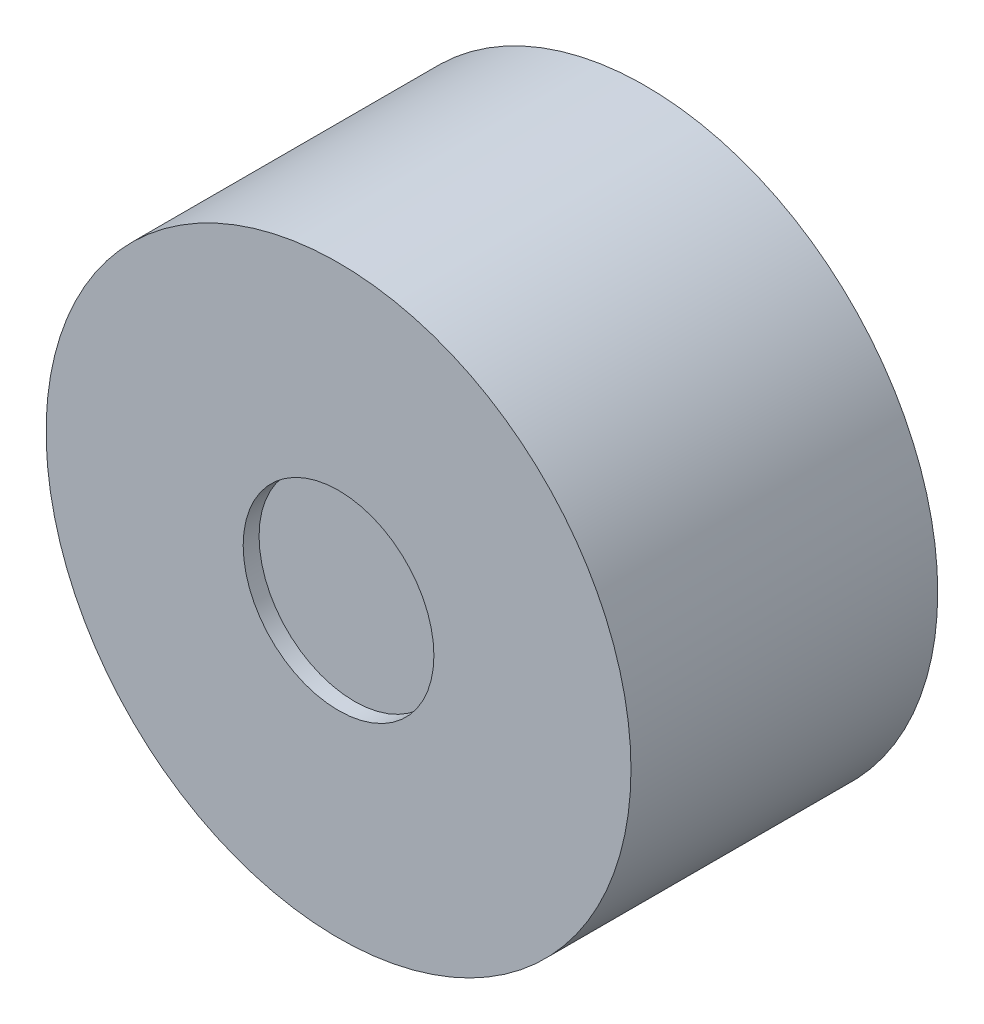
from build123d import *

# Parameters (mm, degrees)
CROQUIS1_R              = 18.4
SALIENTE_EXTRUIR1_DEPTH = 24.3
CROQUIS2_R              = 3
CROQUIS2_R_2            = 1.25
CORTAR_EXTRUIR1_DEPTH   = 5
CORTAR_EXTRUIR2_START   = -5
CROQUIS3_R              = 1.25
CROQUIS3_R_2            = 5
CORTAR_EXTRUIR2_DEPTH   = 5
CORTAR_EXTRUIR3_START   = -5
CROQUIS6_R              = 18.4
CORTAR_EXTRUIR3_DEPTH   = 5
CROQUIS7_R              = 6
CORTAR_EXTRUIR4_DEPTH   = 1


with BuildPart() as part:
    # Croquis1 → Saliente-Extruir1 (new body)
    with BuildSketch(Plane.XY):
        Circle(CROQUIS1_R)
    extrude(amount=SALIENTE_EXTRUIR1_DEPTH)

    # Croquis2 → Cortar-Extruir1 (cut)
    with BuildSketch(Plane.XY.offset(24.3)):
        Circle(CROQUIS2_R)
        with Locations((0, 9.5)):
            Circle(CROQUIS2_R_2)
        with Locations((9.5, 0)):
            Circle(CROQUIS2_R_2)
        with Locations((0, -9.5)):
            Circle(CROQUIS2_R_2)
        with Locations((-9.5, 0)):
            Circle(CROQUIS2_R_2)
    extrude(amount=-CORTAR_EXTRUIR1_DEPTH, mode=Mode.SUBTRACT)

    # Croquis3 → Cortar-Extruir2 (cut)
    with BuildSketch(Plane(origin=(0, 0, 0), x_dir=(-1, 0, 0), z_dir=(0, 0, -1)).offset(CORTAR_EXTRUIR2_START)):
        with Locations(Location((-9.5, 0, 0), (0, 0, 180))):
            Circle(CROQUIS3_R)
        with Locations(Location((0, 9.5, 0), (0, 0, 180))):
            Circle(CROQUIS3_R)
        with Locations(Location((9.5, 0, 0), (0, 0, 180))):
            Circle(CROQUIS3_R)
        with Locations(Location((0, -9.5, 0), (0, 0, 180))):
            Circle(CROQUIS3_R)
        Circle(CROQUIS3_R_2)
    extrude(amount=CORTAR_EXTRUIR2_DEPTH, mode=Mode.SUBTRACT)

    # Croquis6 → Cortar-Extruir3 (cut)
    with BuildSketch(Plane.XY.offset(24.3).offset(CORTAR_EXTRUIR3_START)):
        Circle(CROQUIS6_R)
    extrude(amount=CORTAR_EXTRUIR3_DEPTH, mode=Mode.SUBTRACT)

    # Croquis7 → Cortar-Extruir4 (cut)
    with BuildSketch(Plane.XY.offset(19.3)):
        Circle(CROQUIS7_R)
    extrude(amount=-CORTAR_EXTRUIR4_DEPTH, mode=Mode.SUBTRACT)


solid = part.part
